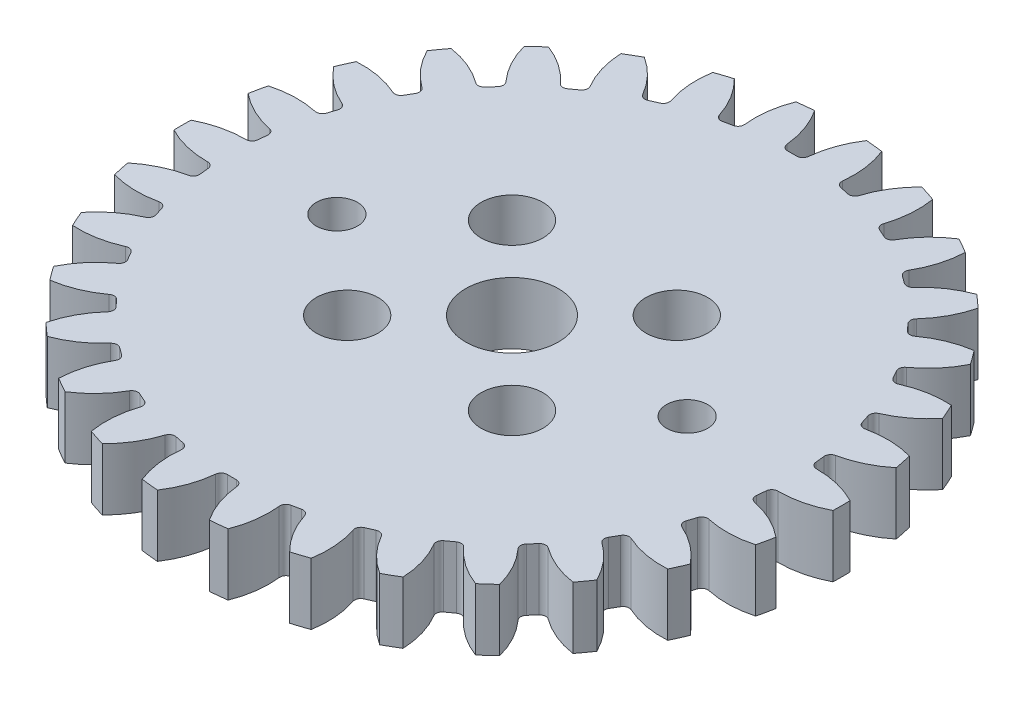
from build123d import *

# Parameters (mm, degrees)
CROQUIS1_R              = 1.5
CROQUIS1_R_2            = 1
CROQUIS1_R_3            = 2.25
SALIENTE_EXTRUIR1_DEPTH = 3


with BuildPart() as part:
    # Croquis1 → Saliente-Extruir1 (new body)
    with BuildSketch(Plane(origin=(0, 0, 0), x_dir=(1, 0, 0), z_dir=(0, 1, 0))):
        with BuildLine():
            Line((0.219874756, 13.6), (-0.219874756, 13.6))
            ThreePointArc((-0.219874756, 13.6), (-0.421386888, 13.677754953), (-0.518441911, 13.870714262))
            ThreePointArc((-0.518441911, 13.870714262), (-0.761174374, 14.956054767), (-1.259418951, 15.950356231))
            ThreePointArc((-1.259418951, 15.950356231), (-1.672455412, 15.912350326), (-2.084367907, 15.863650602))
            ThreePointArc((-2.084367907, 15.863650602), (-2.364997747, 14.787486138), (-2.376770944, 13.67539601))
            ThreePointArc((-2.376770944, 13.67539601), (-2.431586585, 13.466474451), (-2.61252903, 13.348521902))
            Line((-2.61252903, 13.348521902), (-3.042668961, 13.257092838))
            ThreePointArc((-3.042668961, 13.257092838), (-3.255943733, 13.291251931), (-3.390996366, 13.459815741))
            ThreePointArc((-3.390996366, 13.459815741), (-3.854079522, 14.470972036), (-4.548163159, 15.339954755))
            ThreePointArc((-4.548163159, 15.339954755), (-4.94427191, 15.216904261), (-5.337057887, 15.083627319))
            ThreePointArc((-5.337057887, 15.083627319), (-5.387808118, 13.972633406), (-5.168107503, 12.88239733))
            ThreePointArc((-5.168107503, 12.88239733), (-5.178288057, 12.666644397), (-5.330752761, 12.513649344))
            Line((-5.330752761, 12.513649344), (-5.732483931, 12.334787104))
            ThreePointArc((-5.732483931, 12.334787104), (-5.948200212, 12.32385742), (-6.115348008, 12.460658686))
            ThreePointArc((-6.115348008, 12.460658686), (-6.778542901, 13.353438387), (-7.638130812, 14.059123646))
            ThreePointArc((-7.638130812, 14.059123646), (-8, 13.856406461), (-8.356492827, 13.644377144))
            ThreePointArc((-8.356492827, 13.644377144), (-8.17514542, 12.547109547), (-7.733572966, 11.526376071))
            ThreePointArc((-7.733572966, 11.526376071), (-7.698673492, 11.313221201), (-7.815997017, 11.131870263))
            Line((-7.815997017, 11.131870263), (-8.171761846, 10.873391984))
            ThreePointArc((-8.171761846, 10.873391984), (-8.3804918, 10.817851204), (-8.572429598, 10.916911053))
            ThreePointArc((-8.572429598, 10.916911053), (-9.406751429, 11.652295404), (-10.394275496, 12.163841371))
            ThreePointArc((-10.394275496, 12.163841371), (-10.706089702, 11.890317208), (-11.010708931, 11.608802214))
            ThreePointArc((-11.010708931, 11.608802214), (-10.605189639, 10.573216792), (-9.961044179, 9.666596868))
            ThreePointArc((-9.961044179, 9.666596868), (-9.882589954, 9.465355951), (-9.959644697, 9.263575034))
            Line((-9.959644697, 9.263575034), (-10.253894556, 8.936777459))
            ThreePointArc((-10.253894556, 8.936777459), (-10.446515682, 8.83905298), (-10.654854879, 8.896042021))
            ThreePointArc((-10.654854879, 8.896042021), (-11.62383978, 9.441891198), (-12.696140464, 9.73694086))
            ThreePointArc((-12.696140464, 9.73694086), (-12.94427191, 9.404564037), (-13.18370422, 9.065866922))
            ThreePointArc((-13.18370422, 9.065866922), (-12.571736181, 8.137223728), (-11.753169964, 7.384340996))
            ThreePointArc((-11.753169964, 7.384340996), (-11.634589812, 7.203809227), (-11.668008113, 6.990417125))
            Line((-11.668008113, 6.990417125), (-11.88788287, 6.609582875))
            ThreePointArc((-11.88788287, 6.609582875), (-12.0559767, 6.473945727), (-12.271611875, 6.486373266))
            ThreePointArc((-12.271611875, 6.486373266), (-13.332910556, 6.818831039), (-14.443123171, 6.88448931))
            ThreePointArc((-14.443123171, 6.88448931), (-14.616727322, 6.507786289), (-14.780508372, 6.126709742))
            ThreePointArc((-14.780508372, 6.126709742), (-13.988837527, 5.34559494), (-13.031625823, 4.779353988))
            ThreePointArc((-13.031625823, 4.779353988), (-12.878102267, 4.627421471), (-12.866423585, 4.411744443))
            Line((-12.866423585, 4.411744443), (-13.002313658, 3.993517804))
            ThreePointArc((-13.002313658, 3.993517804), (-13.138533686, 3.82589598), (-13.352040545, 3.793218874))
            ThreePointArc((-13.352040545, 3.793218874), (-14.459269161, 3.897755243), (-15.55887209, 3.731152541))
            ThreePointArc((-15.55887209, 3.731152541), (-15.650361612, 3.326587053), (-15.731333383, 2.919785948))
            ThreePointArc((-15.731333383, 2.919785948), (-14.794559546, 2.320338003), (-13.740537101, 1.965486278))
            ThreePointArc((-13.740537101, 1.965486278), (-13.558779857, 1.848793193), (-13.502514607, 1.64025736))
            Line((-13.502514607, 1.64025736), (-13.548480947, 1.202916841))
            ThreePointArc((-13.548480947, 1.202916841), (-13.646873704, 1.010636219), (-13.848920974, 0.934282615))
            ThreePointArc((-13.848920974, 0.934282615), (-14.953688322, 0.80632884), (-15.994623639, 0.414746503))
            ThreePointArc((-15.994623639, 0.414746503), (-16, 0), (-15.994623639, -0.414746503))
            ThreePointArc((-15.994623639, -0.414746503), (-14.953688322, -0.80632884), (-13.848920974, -0.934282615))
            ThreePointArc((-13.848920974, -0.934282615), (-13.646873704, -1.010636219), (-13.548480947, -1.202916841))
            Line((-13.548480947, -1.202916841), (-13.502514607, -1.64025736))
            ThreePointArc((-13.502514607, -1.64025736), (-13.558779857, -1.848793193), (-13.740537101, -1.965486278))
            ThreePointArc((-13.740537101, -1.965486278), (-14.794559546, -2.320338003), (-15.731333383, -2.919785948))
            ThreePointArc((-15.731333383, -2.919785948), (-15.650361612, -3.326587053), (-15.55887209, -3.731152541))
            ThreePointArc((-15.55887209, -3.731152541), (-14.459269161, -3.897755243), (-13.352040545, -3.793218874))
            ThreePointArc((-13.352040545, -3.793218874), (-13.138533686, -3.82589598), (-13.002313658, -3.993517804))
            Line((-13.002313658, -3.993517804), (-12.866423585, -4.411744443))
            ThreePointArc((-12.866423585, -4.411744443), (-12.878102267, -4.627421471), (-13.031625823, -4.779353988))
            ThreePointArc((-13.031625823, -4.779353988), (-13.988837527, -5.34559494), (-14.780508372, -6.126709742))
            ThreePointArc((-14.780508372, -6.126709742), (-14.616727322, -6.507786289), (-14.443123171, -6.88448931))
            ThreePointArc((-14.443123171, -6.88448931), (-13.332910556, -6.818831039), (-12.271611875, -6.486373266))
            ThreePointArc((-12.271611875, -6.486373266), (-12.0559767, -6.473945727), (-11.88788287, -6.609582875))
            Line((-11.88788287, -6.609582875), (-11.668008113, -6.990417125))
            ThreePointArc((-11.668008113, -6.990417125), (-11.634589812, -7.203809227), (-11.753169964, -7.384340996))
            ThreePointArc((-11.753169964, -7.384340996), (-12.571736181, -8.137223728), (-13.18370422, -9.065866922))
            ThreePointArc((-13.18370422, -9.065866922), (-12.94427191, -9.404564037), (-12.696140464, -9.73694086))
            ThreePointArc((-12.696140464, -9.73694086), (-11.62383978, -9.441891198), (-10.654854879, -8.896042021))
            ThreePointArc((-10.654854879, -8.896042021), (-10.446515682, -8.83905298), (-10.253894556, -8.936777459))
            Line((-10.253894556, -8.936777459), (-9.959644697, -9.263575034))
            ThreePointArc((-9.959644697, -9.263575034), (-9.882589954, -9.465355951), (-9.961044179, -9.666596868))
            ThreePointArc((-9.961044179, -9.666596868), (-10.605189639, -10.573216792), (-11.010708931, -11.608802214))
            ThreePointArc((-11.010708931, -11.608802214), (-10.706089702, -11.890317208), (-10.394275496, -12.163841371))
            ThreePointArc((-10.394275496, -12.163841371), (-9.406751429, -11.652295404), (-8.572429598, -10.916911053))
            ThreePointArc((-8.572429598, -10.916911053), (-8.3804918, -10.817851204), (-8.171761846, -10.873391984))
            Line((-8.171761846, -10.873391984), (-7.815997017, -11.131870263))
            ThreePointArc((-7.815997017, -11.131870263), (-7.698673492, -11.313221201), (-7.733572966, -11.526376071))
            ThreePointArc((-7.733572966, -11.526376071), (-8.17514542, -12.547109547), (-8.356492827, -13.644377144))
            ThreePointArc((-8.356492827, -13.644377144), (-8, -13.856406461), (-7.638130812, -14.059123646))
            ThreePointArc((-7.638130812, -14.059123646), (-6.778542901, -13.353438387), (-6.115348008, -12.460658686))
            ThreePointArc((-6.115348008, -12.460658686), (-5.948200212, -12.32385742), (-5.732483931, -12.334787104))
            Line((-5.732483931, -12.334787104), (-5.330752761, -12.513649344))
            ThreePointArc((-5.330752761, -12.513649344), (-5.178288057, -12.666644397), (-5.168107503, -12.88239733))
            ThreePointArc((-5.168107503, -12.88239733), (-5.387808118, -13.972633406), (-5.337057887, -15.083627319))
            ThreePointArc((-5.337057887, -15.083627319), (-4.94427191, -15.216904261), (-4.548163159, -15.339954755))
            ThreePointArc((-4.548163159, -15.339954755), (-3.854079522, -14.470972036), (-3.390996366, -13.459815741))
            ThreePointArc((-3.390996366, -13.459815741), (-3.255943733, -13.291251931), (-3.042668961, -13.257092838))
            Line((-3.042668961, -13.257092838), (-2.61252903, -13.348521902))
            ThreePointArc((-2.61252903, -13.348521902), (-2.431586585, -13.466474451), (-2.376770944, -13.67539601))
            ThreePointArc((-2.376770944, -13.67539601), (-2.364997747, -14.787486138), (-2.084367907, -15.863650602))
            ThreePointArc((-2.084367907, -15.863650602), (-1.672455412, -15.912350326), (-1.259418951, -15.950356231))
            ThreePointArc((-1.259418951, -15.950356231), (-0.761174374, -14.956054767), (-0.518441911, -13.870714262))
            ThreePointArc((-0.518441911, -13.870714262), (-0.421386888, -13.677754953), (-0.219874756, -13.6))
            Line((-0.219874756, -13.6), (0.219874756, -13.6))
            ThreePointArc((0.219874756, -13.6), (0.421386888, -13.677754953), (0.518441911, -13.870714262))
            ThreePointArc((0.518441911, -13.870714262), (0.761174374, -14.956054767), (1.259418951, -15.950356231))
            ThreePointArc((1.259418951, -15.950356231), (1.672455412, -15.912350326), (2.084367907, -15.863650602))
            ThreePointArc((2.084367907, -15.863650602), (2.364997747, -14.787486138), (2.376770944, -13.67539601))
            ThreePointArc((2.376770944, -13.67539601), (2.431586585, -13.466474451), (2.61252903, -13.348521902))
            Line((2.61252903, -13.348521902), (3.042668961, -13.257092838))
            ThreePointArc((3.042668961, -13.257092838), (3.255943733, -13.291251931), (3.390996366, -13.459815741))
            ThreePointArc((3.390996366, -13.459815741), (3.854079522, -14.470972036), (4.548163159, -15.339954755))
            ThreePointArc((4.548163159, -15.339954755), (4.94427191, -15.216904261), (5.337057887, -15.083627319))
            ThreePointArc((5.337057887, -15.083627319), (5.387808118, -13.972633406), (5.168107503, -12.88239733))
            ThreePointArc((5.168107503, -12.88239733), (5.178288057, -12.666644397), (5.330752761, -12.513649344))
            Line((5.330752761, -12.513649344), (5.732483931, -12.334787104))
            ThreePointArc((5.732483931, -12.334787104), (5.948200212, -12.32385742), (6.115348008, -12.460658686))
            ThreePointArc((6.115348008, -12.460658686), (6.778542901, -13.353438387), (7.638130812, -14.059123646))
            ThreePointArc((7.638130812, -14.059123646), (8, -13.856406461), (8.356492827, -13.644377144))
            ThreePointArc((8.356492827, -13.644377144), (8.17514542, -12.547109547), (7.733572966, -11.526376071))
            ThreePointArc((7.733572966, -11.526376071), (7.698673492, -11.313221201), (7.815997017, -11.131870263))
            Line((7.815997017, -11.131870263), (8.171761846, -10.873391984))
            ThreePointArc((8.171761846, -10.873391984), (8.3804918, -10.817851204), (8.572429598, -10.916911053))
            ThreePointArc((8.572429598, -10.916911053), (9.406751429, -11.652295404), (10.394275496, -12.163841371))
            ThreePointArc((10.394275496, -12.163841371), (10.706089702, -11.890317208), (11.010708931, -11.608802214))
            ThreePointArc((11.010708931, -11.608802214), (10.605189639, -10.573216792), (9.961044179, -9.666596868))
            ThreePointArc((9.961044179, -9.666596868), (9.882589954, -9.465355951), (9.959644697, -9.263575034))
            Line((9.959644697, -9.263575034), (10.253894556, -8.936777459))
            ThreePointArc((10.253894556, -8.936777459), (10.446515682, -8.83905298), (10.654854879, -8.896042021))
            ThreePointArc((10.654854879, -8.896042021), (11.62383978, -9.441891198), (12.696140464, -9.73694086))
            ThreePointArc((12.696140464, -9.73694086), (12.94427191, -9.404564037), (13.18370422, -9.065866922))
            ThreePointArc((13.18370422, -9.065866922), (12.571736181, -8.137223728), (11.753169964, -7.384340996))
            ThreePointArc((11.753169964, -7.384340996), (11.634589812, -7.203809227), (11.668008113, -6.990417125))
            Line((11.668008113, -6.990417125), (11.88788287, -6.609582875))
            ThreePointArc((11.88788287, -6.609582875), (12.0559767, -6.473945727), (12.271611875, -6.486373266))
            ThreePointArc((12.271611875, -6.486373266), (13.332910556, -6.818831039), (14.443123171, -6.88448931))
            ThreePointArc((14.443123171, -6.88448931), (14.616727322, -6.507786289), (14.780508372, -6.126709742))
            ThreePointArc((14.780508372, -6.126709742), (13.988837527, -5.34559494), (13.031625823, -4.779353988))
            ThreePointArc((13.031625823, -4.779353988), (12.878102267, -4.627421471), (12.866423585, -4.411744443))
            Line((12.866423585, -4.411744443), (13.002313658, -3.993517804))
            ThreePointArc((13.002313658, -3.993517804), (13.138533686, -3.82589598), (13.352040545, -3.793218874))
            ThreePointArc((13.352040545, -3.793218874), (14.459269161, -3.897755243), (15.55887209, -3.731152541))
            ThreePointArc((15.55887209, -3.731152541), (15.650361612, -3.326587053), (15.731333383, -2.919785948))
            ThreePointArc((15.731333383, -2.919785948), (14.794559546, -2.320338003), (13.740537101, -1.965486278))
            ThreePointArc((13.740537101, -1.965486278), (13.558779857, -1.848793193), (13.502514607, -1.64025736))
            Line((13.502514607, -1.64025736), (13.548480947, -1.202916841))
            ThreePointArc((13.548480947, -1.202916841), (13.646873704, -1.010636219), (13.848920974, -0.934282615))
            ThreePointArc((13.848920974, -0.934282615), (14.953688322, -0.80632884), (15.994623639, -0.414746503))
            ThreePointArc((15.994623639, -0.414746503), (15.998655853, -0.207390674), (16, 0))
            ThreePointArc((16, 0), (15.998655853, 0.207390674), (15.994623639, 0.414746503))
            ThreePointArc((15.994623639, 0.414746503), (14.953688322, 0.80632884), (13.848920974, 0.934282615))
            ThreePointArc((13.848920974, 0.934282615), (13.646873704, 1.010636219), (13.548480947, 1.202916841))
            Line((13.548480947, 1.202916841), (13.502514607, 1.64025736))
            ThreePointArc((13.502514607, 1.64025736), (13.558779857, 1.848793193), (13.740537101, 1.965486278))
            ThreePointArc((13.740537101, 1.965486278), (14.794559546, 2.320338003), (15.731333383, 2.919785948))
            ThreePointArc((15.731333383, 2.919785948), (15.650361612, 3.326587053), (15.55887209, 3.731152541))
            ThreePointArc((15.55887209, 3.731152541), (14.459269161, 3.897755243), (13.352040545, 3.793218874))
            ThreePointArc((13.352040545, 3.793218874), (13.138533686, 3.82589598), (13.002313658, 3.993517804))
            Line((13.002313658, 3.993517804), (12.866423585, 4.411744443))
            ThreePointArc((12.866423585, 4.411744443), (12.878102267, 4.627421471), (13.031625823, 4.779353988))
            ThreePointArc((13.031625823, 4.779353988), (13.988837527, 5.34559494), (14.780508372, 6.126709742))
            ThreePointArc((14.780508372, 6.126709742), (14.616727322, 6.507786289), (14.443123171, 6.88448931))
            ThreePointArc((14.443123171, 6.88448931), (13.332910556, 6.818831039), (12.271611875, 6.486373266))
            ThreePointArc((12.271611875, 6.486373266), (12.0559767, 6.473945727), (11.88788287, 6.609582875))
            Line((11.88788287, 6.609582875), (11.668008113, 6.990417125))
            ThreePointArc((11.668008113, 6.990417125), (11.634589812, 7.203809227), (11.753169964, 7.384340996))
            ThreePointArc((11.753169964, 7.384340996), (12.571736181, 8.137223728), (13.18370422, 9.065866922))
            ThreePointArc((13.18370422, 9.065866922), (12.94427191, 9.404564037), (12.696140464, 9.73694086))
            ThreePointArc((12.696140464, 9.73694086), (11.62383978, 9.441891198), (10.654854879, 8.896042021))
            ThreePointArc((10.654854879, 8.896042021), (10.446515682, 8.83905298), (10.253894556, 8.936777459))
            Line((10.253894556, 8.936777459), (9.959644697, 9.263575034))
            ThreePointArc((9.959644697, 9.263575034), (9.882589954, 9.465355951), (9.961044179, 9.666596868))
            ThreePointArc((9.961044179, 9.666596868), (10.605189639, 10.573216792), (11.010708931, 11.608802214))
            ThreePointArc((11.010708931, 11.608802214), (10.706089702, 11.890317208), (10.394275496, 12.163841371))
            ThreePointArc((10.394275496, 12.163841371), (9.406751429, 11.652295404), (8.572429598, 10.916911053))
            ThreePointArc((8.572429598, 10.916911053), (8.3804918, 10.817851204), (8.171761846, 10.873391984))
            Line((8.171761846, 10.873391984), (7.815997017, 11.131870263))
            ThreePointArc((7.815997017, 11.131870263), (7.698673492, 11.313221201), (7.733572966, 11.526376071))
            ThreePointArc((7.733572966, 11.526376071), (8.17514542, 12.547109547), (8.356492827, 13.644377144))
            ThreePointArc((8.356492827, 13.644377144), (8, 13.856406461), (7.638130812, 14.059123646))
            ThreePointArc((7.638130812, 14.059123646), (6.778542901, 13.353438387), (6.115348008, 12.460658686))
            ThreePointArc((6.115348008, 12.460658686), (5.948200212, 12.32385742), (5.732483931, 12.334787104))
            Line((5.732483931, 12.334787104), (5.330752761, 12.513649344))
            ThreePointArc((5.330752761, 12.513649344), (5.178288057, 12.666644397), (5.168107503, 12.88239733))
            ThreePointArc((5.168107503, 12.88239733), (5.387808118, 13.972633406), (5.337057887, 15.083627319))
            ThreePointArc((5.337057887, 15.083627319), (4.94427191, 15.216904261), (4.548163159, 15.339954755))
            ThreePointArc((4.548163159, 15.339954755), (3.854079522, 14.470972036), (3.390996366, 13.459815741))
            ThreePointArc((3.390996366, 13.459815741), (3.255943733, 13.291251931), (3.042668961, 13.257092838))
            Line((3.042668961, 13.257092838), (2.61252903, 13.348521902))
            ThreePointArc((2.61252903, 13.348521902), (2.431586585, 13.466474451), (2.376770944, 13.67539601))
            ThreePointArc((2.376770944, 13.67539601), (2.364997747, 14.787486138), (2.084367907, 15.863650602))
            ThreePointArc((2.084367907, 15.863650602), (1.672455412, 15.912350326), (1.259418951, 15.950356231))
            ThreePointArc((1.259418951, 15.950356231), (0.761174374, 14.956054767), (0.518441911, 13.870714262))
            ThreePointArc((0.518441911, 13.870714262), (0.421386888, 13.677754953), (0.219874756, 13.6))
        make_face()
        with Locations(Location((-4, -4, 0), (0, 0, 270))):
            Circle(CROQUIS1_R, mode=Mode.SUBTRACT)
        with Locations(Location((4, -4, 0), (0, 0, 270))):
            Circle(CROQUIS1_R, mode=Mode.SUBTRACT)
        with Locations(Location((-8.5, 0, 0), (0, 0, 270))):
            Circle(CROQUIS1_R_2, mode=Mode.SUBTRACT)
        with Locations(Location((-4, 4, 0), (0, 0, 270))):
            Circle(CROQUIS1_R, mode=Mode.SUBTRACT)
        with Locations(Location((0, 0, 0), (0, 0, 270))):
            Circle(CROQUIS1_R_3, mode=Mode.SUBTRACT)
        with Locations(Location((4, 4, 0), (0, 0, 270))):
            Circle(CROQUIS1_R, mode=Mode.SUBTRACT)
        with Locations(Location((8.5, 0, 0), (0, 0, 270))):
            Circle(CROQUIS1_R_2, mode=Mode.SUBTRACT)
    extrude(amount=SALIENTE_EXTRUIR1_DEPTH)


solid = part.part
